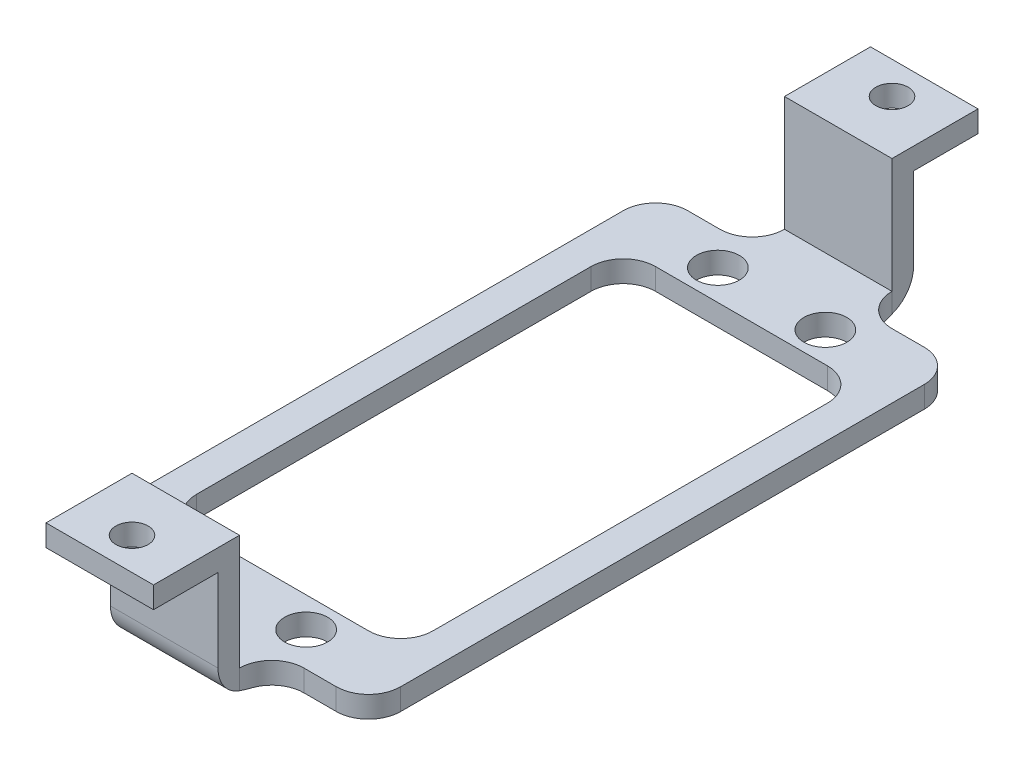
from build123d import *

# Parameters (mm, degrees)
BOSS_EXTRUDE2_DEPTH      = 2
SKETCH3_R                = 2
CUT_EXTRUDE1_DEPTH       = 2
BOSS_EXTRUDE3_DEPTH      = 5
BOSS_EXTRUDE3_DEPTH_BACK = 5
BOSS_EXTRUDE3_START      = -14
BOSS_EXTRUDE4_START      = -19
BOSS_EXTRUDE4_DEPTH      = 10
SKETCH5_R                = 1.5
CUT_EXTRUDE2_DEPTH       = 5
FILLET1_R                = 3
FILLET2_R                = 3


with BuildPart() as part:
    # Sketch2 → Boss-Extrude2 (new body)
    with BuildSketch(Plane(origin=(0, 0, -0.175945046), x_dir=(1, 0, 0), z_dir=(0, 1, 0))):
        Polygon((10, 12.615523277), (10, -28.082679321), (10, -35.082679321), (38, -35.082679321), (38, -28.082679321), (38, 12.615523277), (38, 19.615523277), (10, 19.615523277), align=None)
        Polygon((13, -7.733578022), (13, 12.615523277), (13, 13.615523277), (35, 13.615523277), (35, 12.615523277), (35, -7.733578022), (35, -28.082679321), (35, -29.082679321), (13, -29.082679321), (13, -28.082679321), align=None, mode=Mode.SUBTRACT)
    extrude(amount=BOSS_EXTRUDE2_DEPTH)

    # Sketch3 → Cut-Extrude1 (cut)
    with BuildSketch(Plane(origin=(0, 2, 0), x_dir=(1, 0, 0), z_dir=(0, 1, 0))):
        with Locations(Location((29, -31.707632976, 0), (0, 0, 270))):
            Circle(SKETCH3_R)
        with Locations(Location((19, -31.707632976, 0), (0, 0, 270))):
            Circle(SKETCH3_R)
        with Locations(Location((19, 16.592367024, 0), (0, 0, 270))):
            Circle(SKETCH3_R)
        with Locations(Location((29, 16.592367024, 0), (0, 0, 270))):
            Circle(SKETCH3_R)
    extrude(amount=-CUT_EXTRUDE1_DEPTH, mode=Mode.SUBTRACT)

    # Sketch4 → Boss-Extrude3 (add, two sides: drawn at the far end of the back side and taken through both)
    with BuildSketch(Plane(origin=(38, 0, 0), x_dir=(0, 0, -1), z_dir=(1, 0, 0)).offset(BOSS_EXTRUDE3_START - BOSS_EXTRUDE3_DEPTH_BACK)):
        Polygon((-34.906734274, 0), (-39.906734274, 0), (-39.906734274, 10.7), (-45.906734274, 10.7), (-45.906734274, 12.7), (-40.011651192, 12.7), (-37.906734274, 12.7), (-37.906734274, 2), (-34.906734274, 2), align=None)
    extrude(amount=BOSS_EXTRUDE3_DEPTH + BOSS_EXTRUDE3_DEPTH_BACK)

    # Sketch6 → Boss-Extrude4 (add)
    with BuildSketch(Plane(origin=(38, 0, 0), x_dir=(0, 0, -1), z_dir=(1, 0, 0)).offset(BOSS_EXTRUDE4_START)):
        Polygon((24.791468323, 0), (19.791468323, 0), (19.791468323, 2), (22.791468323, 2), (22.791468323, 12.7), (30.791468323, 12.7), (30.791468323, 10.7), (24.791468323, 10.7), align=None)
    extrude(amount=BOSS_EXTRUDE4_DEPTH)

    # Sketch5 → Cut-Extrude2 (cut)
    with BuildSketch(Plane.XZ.offset(-10.7)):
        with Locations(Location((24, -27.791468323, 0), (0, 0, 270))):
            Circle(SKETCH5_R)
        with Locations(Location((24, 42.906734274, 0), (0, 0, 270))):
            Circle(SKETCH5_R)
    extrude(amount=-CUT_EXTRUDE2_DEPTH, mode=Mode.SUBTRACT)

    # Fillet1
    fillet1_edges = [part.edges().sort_by_distance(p)[0] for p in [
        (38, 1, 34.906734274),
        (10, 1, 34.906734274),
        (10, 1, -19.791468323),
        (35, 1, 28.906734274),
        (35, 1, -13.791468323),
        (13, 1, 28.906734274),
        (13, 1, -13.791468323),
        (38, 1, -19.791468323),
        (29, 1, -19.791468323),
        (19, 1, -19.791468323),
        (19, 1, 34.906734274),
        (29, 1, 34.906734274),
    ]]
    fillet(fillet1_edges, radius=FILLET1_R)

    # Fillet2
    fillet2_edges = [part.edges().sort_by_distance(p)[0] for p in [
        (24, 0, -24.791468323),
        (24, 0, 39.906734274),
    ]]
    fillet(fillet2_edges, radius=FILLET2_R)


solid = part.part
